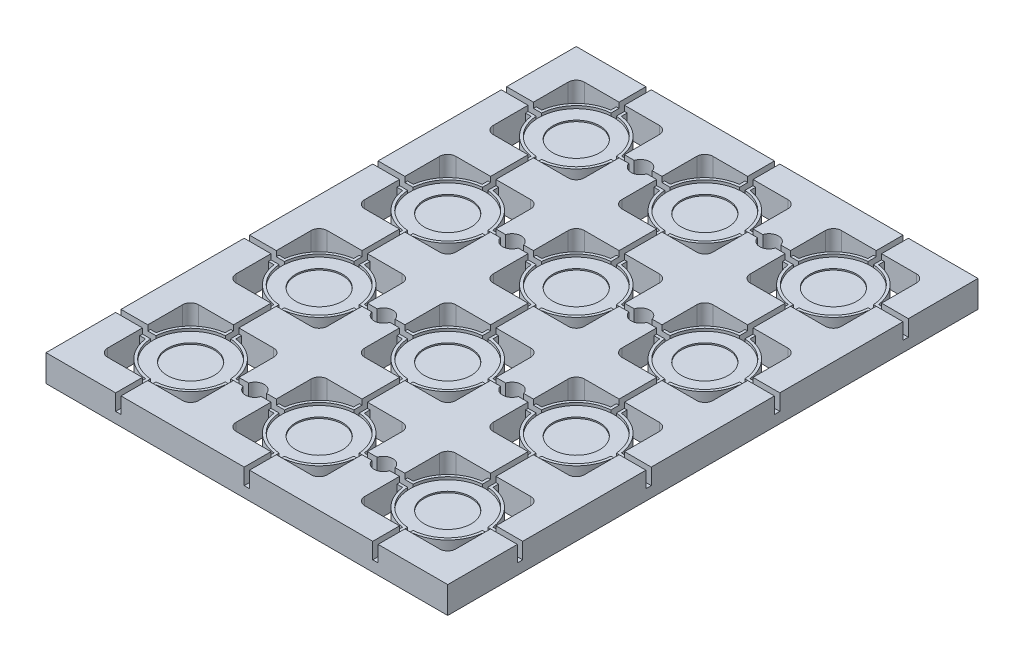
from build123d import *

# Parameters (mm, degrees)
SKETCH1_W            = 150
SKETCH1_H            = 198
BOSS_EXTRUDE1_DEPTH  = 10
CUT_EXTRUDE2_DEPTH   = 125.603370741
CUT_EXTRUDE3_DEPTH   = 2
SKETCH4_R            = 14
CUT_EXTRUDE4_DEPTH   = 1
SKETCH5_W            = 2
SKETCH5_H            = 10
SKETCH5_W_2          = 10
SKETCH5_H_2          = 2
CUT_EXTRUDE5_DEPTH   = 6
SKETCH7_R            = 8.75
CUT_EXTRUDE7_DEPTH   = 0.5
LPATTERN2_COUNT      = 3
LPATTERN2_PITCH      = 48
LPATTERN2_COUNT_DIR2 = 4
LPATTERN2_PITCH_DIR2 = 48
SKETCH9_R            = 3.5
CUT_EXTRUDE9_DEPTH   = 125.603370741
LPATTERN3_COUNT      = 2
LPATTERN3_PITCH      = 48
LPATTERN3_COUNT_DIR2 = 4
LPATTERN3_PITCH_DIR2 = 48


with BuildPart() as part:
    # Sketch1 → Boss-Extrude1 (new body)
    with BuildSketch(Plane(origin=(0, 0, 0), x_dir=(1, 0, 0), z_dir=(0, 1, 0))):
        Rectangle(SKETCH1_W, SKETCH1_H)
    extrude(amount=BOSS_EXTRUDE1_DEPTH)

    # Sketch2 → Cut-Extrude2 (cut, through all)
    with BuildSketch(Plane(origin=(0, 10, 0), x_dir=(1, 0, 0), z_dir=(0, 1, 0))):
        with BuildLine():
            ThreePointArc((-65, 58), (-64.121320344, 55.878679656), (-62, 55))
            Line((-62, 55), (-50, 55))
            Line((-50, 55), (-50, 57.133931253))
            ThreePointArc((-50, 57.133931253), (-58.606601718, 61.393398282), (-62.866068747, 70))
            Line((-62.866068747, 70), (-65, 70))
            Line((-65, 70), (-65, 58))
        make_face()
        with BuildLine():
            Line((-46, 57.133931253), (-46, 55))
            Line((-46, 55), (-34, 55))
            ThreePointArc((-34, 55), (-31.878679656, 55.878679656), (-31, 58))
            Line((-31, 58), (-31, 70))
            Line((-31, 70), (-33.133931253, 70))
            ThreePointArc((-33.133931253, 70), (-37.393398282, 61.393398282), (-46, 57.133931253))
        make_face()
        with BuildLine():
            Line((-65, 86), (-65, 74))
            Line((-65, 74), (-62.866068747, 74))
            ThreePointArc((-62.866068747, 74), (-58.606601718, 82.606601718), (-50, 86.866068747))
            Line((-50, 86.866068747), (-50, 89))
            Line((-50, 89), (-62, 89))
            ThreePointArc((-62, 89), (-64.121320344, 88.121320344), (-65, 86))
        make_face()
        with BuildLine():
            Line((-33.133931253, 74), (-31, 74))
            Line((-31, 74), (-31, 86))
            ThreePointArc((-31, 86), (-31.878679656, 88.121320344), (-34, 89))
            Line((-34, 89), (-46, 89))
            Line((-46, 89), (-46, 86.866068747))
            ThreePointArc((-46, 86.866068747), (-37.393398282, 82.606601718), (-33.133931253, 74))
        make_face()
    cut_extrude2 = extrude(amount=-CUT_EXTRUDE2_DEPTH, mode=Mode.SUBTRACT)

    # Sketch3 → Cut-Extrude3 (cut)
    with BuildSketch(Plane(origin=(0, 10, 0), x_dir=(1, 0, 0), z_dir=(0, 1, 0))):
        with BuildLine():
            Line((-31, 58), (-31, 86))
            ThreePointArc((-31, 86), (-31.878679656, 88.121320344), (-34, 89))
            Line((-34, 89), (-62, 89))
            ThreePointArc((-62, 89), (-64.121320344, 88.121320344), (-65, 86))
            Line((-65, 86), (-65, 58))
            ThreePointArc((-65, 58), (-64.121320344, 55.878679656), (-62, 55))
            Line((-62, 55), (-34, 55))
            ThreePointArc((-34, 55), (-31.878679656, 55.878679656), (-31, 58))
        make_face()
    cut_extrude3 = extrude(amount=-CUT_EXTRUDE3_DEPTH, mode=Mode.SUBTRACT)

    # Sketch4 → Cut-Extrude4 (cut)
    with BuildSketch(Plane(origin=(0, 8, 0), x_dir=(1, 0, 0), z_dir=(0, 1, 0))):
        with Locations(Location((-48, 72, 0), (0, 0, 270))):
            Circle(SKETCH4_R)
    cut_extrude4 = extrude(amount=-CUT_EXTRUDE4_DEPTH, mode=Mode.SUBTRACT)

    # Sketch5 → Cut-Extrude5 (cut)
    with BuildSketch(Plane(origin=(0, 10, 0), x_dir=(1, 0, 0), z_dir=(0, 1, 0))):
        with Locations((-48, 50)):
            Rectangle(SKETCH5_W, SKETCH5_H)
        with BuildLine():
            Line((-47, 55), (-47, 58.035759956))
            ThreePointArc((-47, 58.035759956), (-48, 58), (-49, 58.035759956))
            Line((-49, 58.035759956), (-49, 55))
            Line((-49, 55), (-47, 55))
        make_face()
        with Locations((-26, 72)):
            Rectangle(SKETCH5_W_2, SKETCH5_H_2)
        with BuildLine():
            Line((-31, 73), (-34.035759956, 73))
            ThreePointArc((-34.035759956, 73), (-34, 72), (-34.035759956, 71))
            Line((-34.035759956, 71), (-31, 71))
            Line((-31, 71), (-31, 73))
        make_face()
        with BuildLine():
            Line((-47, 89), (-49, 89))
            Line((-49, 89), (-49, 85.964240044))
            ThreePointArc((-49, 85.964240044), (-48, 86), (-47, 85.964240044))
            Line((-47, 85.964240044), (-47, 89))
        make_face()
        with Locations((-48, 94)):
            Rectangle(SKETCH5_W, SKETCH5_H)
        with Locations((-70, 72)):
            Rectangle(SKETCH5_W_2, SKETCH5_H_2)
        with BuildLine():
            Line((-61.964240044, 73), (-65, 73))
            Line((-65, 73), (-65, 71))
            Line((-65, 71), (-61.964240044, 71))
            ThreePointArc((-61.964240044, 71), (-62, 72), (-61.964240044, 73))
        make_face()
    cut_extrude5 = extrude(amount=-CUT_EXTRUDE5_DEPTH, mode=Mode.SUBTRACT)

    # Sketch7 → Cut-Extrude7 (cut)
    with BuildSketch(Plane(origin=(0, 7, 0), x_dir=(1, 0, 0), z_dir=(0, 1, 0))):
        with Locations(Location((-48, 72, 0), (0, 0, 270))):
            Circle(SKETCH7_R)
    cut_extrude7 = extrude(amount=-CUT_EXTRUDE7_DEPTH, mode=Mode.SUBTRACT)

    # LPattern2: Cut-Extrude2, Cut-Extrude3, Cut-Extrude4, Cut-Extrude5, Cut-Extrude7 3 × 4
    with Locations(*[(i * LPATTERN2_PITCH, 0, j * LPATTERN2_PITCH_DIR2) for i in range(LPATTERN2_COUNT) for j in range(LPATTERN2_COUNT_DIR2) if (i, j) != (0, 0)]):
        add(cut_extrude2, mode=Mode.SUBTRACT)
        add(cut_extrude3, mode=Mode.SUBTRACT)
        add(cut_extrude4, mode=Mode.SUBTRACT)
        add(cut_extrude5, mode=Mode.SUBTRACT)
        add(cut_extrude7, mode=Mode.SUBTRACT)

    # Sketch9 → Cut-Extrude9 (cut, through all)
    with BuildSketch(Plane(origin=(0, 10, 0), x_dir=(1, 0, 0), z_dir=(0, 1, 0))):
        with Locations(Location((-24, 72, 0), (0, 0, 270))):
            Circle(SKETCH9_R)
    cut_extrude9 = extrude(amount=-CUT_EXTRUDE9_DEPTH, mode=Mode.SUBTRACT)

    # LPattern3: Cut-Extrude9 2 × 4
    with Locations(*[(i * LPATTERN3_PITCH, 0, j * LPATTERN3_PITCH_DIR2) for i in range(LPATTERN3_COUNT) for j in range(LPATTERN3_COUNT_DIR2) if (i, j) != (0, 0)]):
        add(cut_extrude9, mode=Mode.SUBTRACT)


solid = part.part
